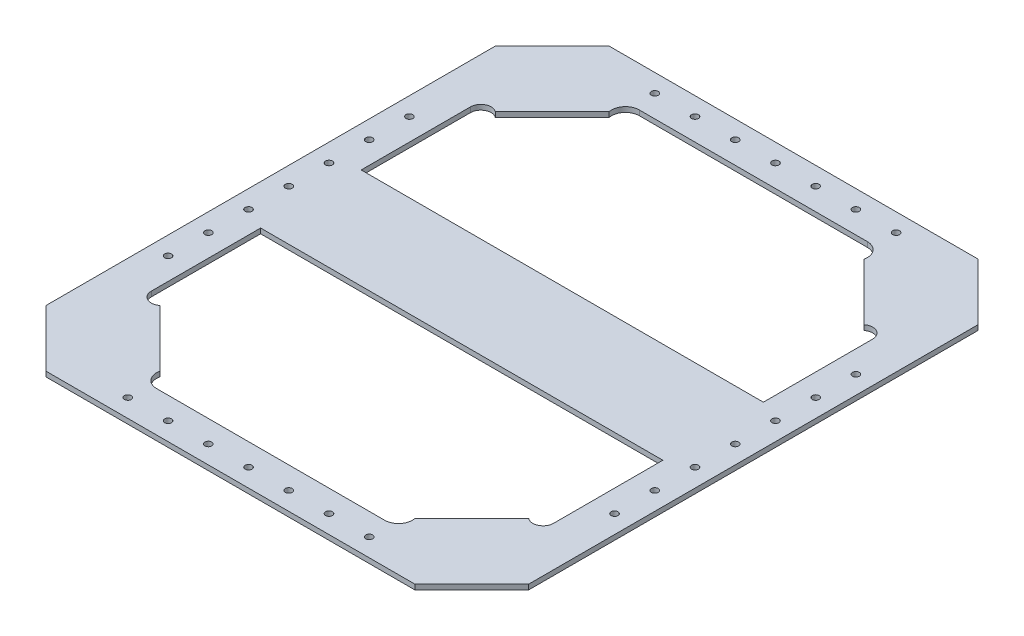
from build123d import *

# Parameters (mm, degrees)
BOSS_EXTRUDE1_DEPTH = 3.175
CUT_EXTRUDE1_DEPTH  = 252.960239461
BOSS_EXTRUDE2_DEPTH = 3.175
SKETCH4_R           = 2.159
CUT_EXTRUDE2_DEPTH  = 252.960239461


with BuildPart() as part:
    # Sketch1 → Boss-Extrude1 (new body)
    with BuildSketch(Plane(origin=(0, 0, 0), x_dir=(1, 0, 0), z_dir=(0, 1, 0))):
        Polygon((-152.4, 119.059630377), (-116.478975516, 154.980654861), (116.478975516, 154.980654861), (152.4, 119.059630377), (152.4, -164.698320655), (116.478975516, -200.619345139), (-116.478975516, -200.619345139), (-152.4, -164.698320655), align=None)
    extrude(amount=BOSS_EXTRUDE1_DEPTH)

    # Sketch2 → Cut-Extrude1 (cut, through all)
    with BuildSketch(Plane(origin=(0, 3.175, 0), x_dir=(1, 0, 0), z_dir=(0, 1, 0))):
        Polygon((-91.078975516, 129.580654861), (91.078975516, 129.580654861), (127, 93.659630377), (127, 8.930654861), (82.442975516, 8.930654861), (-74.314975516, 8.930654861), (-127, 8.930654861), (-127, 93.659630377), align=None)
        Polygon((127, -139.298320655), (91.078975516, -175.219345139), (-91.078975516, -175.219345139), (-127, -139.298320655), (-127, -54.569345139), (-74.314975516, -54.569345139), (82.442975516, -54.569345139), (127, -54.569345139), align=None)
    extrude(amount=-CUT_EXTRUDE1_DEPTH, mode=Mode.SUBTRACT)

    # Sketch5 → Boss-Extrude2 (add)
    with BuildSketch(Plane(origin=(0, 3.175, 0), x_dir=(1, 0, 0), z_dir=(0, 1, 0))):
        with BuildLine():
            Line((-116.478975516, 83.138605892), (-80.557951031, 119.059630377))
            ThreePointArc((-80.557951031, 119.059630377), (-78.800891411, 126.352814743), (-72.028975516, 129.580654861))
            Line((-72.028975516, 129.580654861), (-59.328975516, 129.580654861))
            Line((-59.328975516, 129.580654861), (-59.328975516, 154.980654861))
            Line((-59.328975516, 154.980654861), (-116.478975516, 154.980654861))
            Line((-116.478975516, 154.980654861), (-152.4, 119.059630377))
            Line((-152.4, 119.059630377), (-152.4, 65.258187686))
            Line((-152.4, 65.258187686), (-127, 65.258187686))
            Line((-127, 65.258187686), (-127, 77.958187686))
            ThreePointArc((-127, 77.958187686), (-123.351279088, 83.821819005), (-116.478975516, 83.138605892))
        make_face()
        with BuildLine():
            Line((127, 65.258187686), (127, 77.958187686))
            ThreePointArc((127, 77.958187686), (123.351279088, 83.821819005), (116.478975516, 83.138605892))
            Line((116.478975516, 83.138605892), (80.557951031, 119.059630377))
            ThreePointArc((80.557951031, 119.059630377), (78.800891411, 126.352814743), (72.028975516, 129.580654861))
            Line((72.028975516, 129.580654861), (59.328975516, 129.580654861))
            Line((59.328975516, 129.580654861), (59.328975516, 154.980654861))
            Line((59.328975516, 154.980654861), (116.478975516, 154.980654861))
            Line((116.478975516, 154.980654861), (152.4, 119.059630377))
            Line((152.4, 119.059630377), (152.4, 65.258187686))
            Line((152.4, 65.258187686), (127, 65.258187686))
        make_face()
        with BuildLine():
            Line((116.478975516, -128.777296171), (80.557951031, -164.698320655))
            ThreePointArc((80.557951031, -164.698320655), (78.800891411, -171.991505021), (72.028975516, -175.219345139))
            Line((72.028975516, -175.219345139), (59.328975516, -175.219345139))
            Line((59.328975516, -175.219345139), (59.328975516, -200.619345139))
            Line((59.328975516, -200.619345139), (116.478975516, -200.619345139))
            Line((116.478975516, -200.619345139), (152.4, -164.698320655))
            Line((152.4, -164.698320655), (152.4, -110.896877964))
            Line((152.4, -110.896877964), (127, -110.896877964))
            Line((127, -110.896877964), (127, -123.596877964))
            ThreePointArc((127, -123.596877964), (123.351279088, -129.460509283), (116.478975516, -128.777296171))
        make_face()
        with BuildLine():
            Line((-127, -110.896877964), (-127, -123.596877964))
            ThreePointArc((-127, -123.596877964), (-123.351279088, -129.460509283), (-116.478975516, -128.777296171))
            Line((-116.478975516, -128.777296171), (-80.557951031, -164.698320655))
            ThreePointArc((-80.557951031, -164.698320655), (-78.800891411, -171.991505021), (-72.028975516, -175.219345139))
            Line((-72.028975516, -175.219345139), (-59.328975516, -175.219345139))
            Line((-59.328975516, -175.219345139), (-59.328975516, -200.619345139))
            Line((-59.328975516, -200.619345139), (-116.478975516, -200.619345139))
            Line((-116.478975516, -200.619345139), (-152.4, -164.698320655))
            Line((-152.4, -164.698320655), (-152.4, -110.896877964))
            Line((-152.4, -110.896877964), (-127, -110.896877964))
        make_face()
    extrude(amount=-BOSS_EXTRUDE2_DEPTH)

    # Sketch4 → Cut-Extrude2 (cut, through all)
    with BuildSketch(Plane(origin=(0, 3.175, 0), x_dir=(1, 0, 0), z_dir=(0, 1, 0))):
        with Locations(Location((0, 143.550654861, 0), (0, 0, 270))):
            Circle(SKETCH4_R)
        with Locations(Location((-50.8, 143.550654861, 0), (0, 0, 270))):
            Circle(SKETCH4_R)
        with Locations(Location((50.8, 143.550654861, 0), (0, 0, 270))):
            Circle(SKETCH4_R)
        with Locations(Location((-25.4, 143.550654861, 0), (0, 0, 270))):
            Circle(SKETCH4_R)
        with Locations(Location((25.4, 143.550654861, 0), (0, 0, 270))):
            Circle(SKETCH4_R)
        with Locations(Location((-140.97, -22.819345139, 0), (0, 0, 270))):
            Circle(SKETCH4_R)
        with Locations(Location((-140.97, 2.580654861, 0), (0, 0, 270))):
            Circle(SKETCH4_R)
        with Locations(Location((-140.97, 27.980654861, 0), (0, 0, 270))):
            Circle(SKETCH4_R)
        with Locations(Location((140.97, -22.819345139, 0), (0, 0, 270))):
            Circle(SKETCH4_R)
        with Locations(Location((140.97, 2.580654861, 0), (0, 0, 270))):
            Circle(SKETCH4_R)
        with Locations(Location((140.97, 27.980654861, 0), (0, 0, 270))):
            Circle(SKETCH4_R)
        with Locations(Location((140.97, -73.619345139, 0), (0, 0, 90))):
            Circle(SKETCH4_R)
        with Locations(Location((140.97, -48.219345139, 0), (0, 0, 90))):
            Circle(SKETCH4_R)
        with Locations(Location((-140.97, -73.619345139, 0), (0, 0, 90))):
            Circle(SKETCH4_R)
        with Locations(Location((-140.97, -48.219345139, 0), (0, 0, 90))):
            Circle(SKETCH4_R)
        with Locations(Location((25.4, -189.189345139, 0), (0, 0, 90))):
            Circle(SKETCH4_R)
        with Locations(Location((-25.4, -189.189345139, 0), (0, 0, 90))):
            Circle(SKETCH4_R)
        with Locations(Location((50.8, -189.189345139, 0), (0, 0, 90))):
            Circle(SKETCH4_R)
        with Locations(Location((-50.8, -189.189345139, 0), (0, 0, 90))):
            Circle(SKETCH4_R)
        with Locations(Location((0, -189.189345139, 0), (0, 0, 90))):
            Circle(SKETCH4_R)
        with Locations(Location((-76.2, 143.550654861, 0), (0, 0, 270))):
            Circle(SKETCH4_R)
        with Locations(Location((76.2, 143.550654861, 0), (0, 0, 270))):
            Circle(SKETCH4_R)
        with Locations(Location((-140.97, 53.380654861, 0), (0, 0, 270))):
            Circle(SKETCH4_R)
        with Locations(Location((140.97, 53.380654861, 0), (0, 0, 270))):
            Circle(SKETCH4_R)
        with Locations(Location((140.97, -99.019345139, 0), (0, 0, 90))):
            Circle(SKETCH4_R)
        with Locations(Location((76.2, -189.189345139, 0), (0, 0, 90))):
            Circle(SKETCH4_R)
        with Locations(Location((-76.2, -189.189345139, 0), (0, 0, 90))):
            Circle(SKETCH4_R)
        with Locations(Location((-140.97, -99.019345139, 0), (0, 0, 90))):
            Circle(SKETCH4_R)
    extrude(amount=-CUT_EXTRUDE2_DEPTH, mode=Mode.SUBTRACT)


solid = part.part
